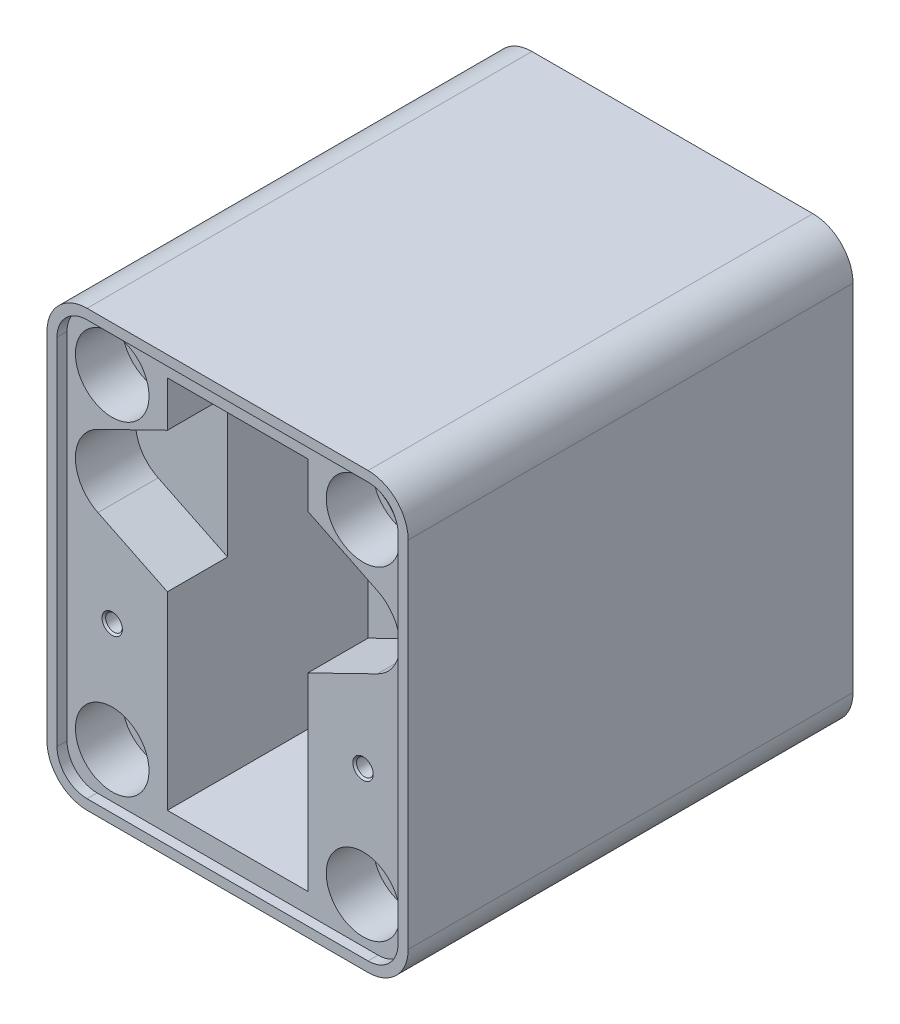
from build123d import *

# Parameters (mm, degrees)
SKETCH1_W                   = 54
SKETCH1_H                   = 65
BOSS_EXTRUDE1_DEPTH         = 65
SKETCH2_W                   = 21
SKETCH2_H                   = 41.5
CUT_EXTRUDE1_DEPTH          = 107.611444039
FILLET1_R                   = 6
SKETCH3_W                   = 21
SKETCH3_H                   = 56
CUT_EXTRUDE2_DEPTH          = 32
CUT_EXTRUDE_THIN3_DEPTH     = 9
CUT_EXTRUDE3_DEPTH          = 9
M3_TAPPED_HOLE1_D           = 2.5
M3_TAPPED_HOLE1_CSINK_D     = 3.05
M3_TAPPED_HOLE1_CSINK_ANGLE = 90
HOLE1_D                     = 6.5
HOLE1_CBORE_D               = 11
HOLE1_CBORE_DEPTH           = 7
EXTRUDE_THIN1_START         = 1.5
EXTRUDE_THIN1_DEPTH         = 1.5
M3_TAPPED_HOLE2_D           = 2.5
M3_TAPPED_HOLE2_CSINK_D     = 3.05
M3_TAPPED_HOLE2_CSINK_ANGLE = 90


with BuildPart() as part:
    # Sketch1 → Boss-Extrude1 (new body)
    with BuildSketch(Plane.XY):
        with Locations((27, 32.5)):
            Rectangle(SKETCH1_W, SKETCH1_H)
    extrude(amount=BOSS_EXTRUDE1_DEPTH)

    # Sketch2 → Cut-Extrude1 (cut, through all)
    with BuildSketch(Plane.XY.offset(65)):
        with Locations((27, 32.5)):
            Rectangle(SKETCH2_W, SKETCH2_H)
    extrude(amount=-CUT_EXTRUDE1_DEPTH, mode=Mode.SUBTRACT)

    # Fillet1
    fillet1_edges = [part.edges().sort_by_distance(p)[0] for p in [
        (0, 65, 32.5),
        (0, 0, 32.5),
        (54, 65, 32.5),
        (54, 0, 32.5),
    ]]
    fillet(fillet1_edges, radius=FILLET1_R)

    # Sketch3 → Cut-Extrude2 (cut)
    with BuildSketch(Plane.XY.offset(65)):
        with Locations((27, 32.5)):
            Rectangle(SKETCH3_W, SKETCH3_H)
    extrude(amount=-CUT_EXTRUDE2_DEPTH, mode=Mode.SUBTRACT)

    # Sketch4 → Cut-Extrude-Thin3 (cut)
    with BuildSketch(Plane.XY.offset(65)):
        with BuildLine():
            Line((6.119863014, 48.642808121), (20.863013699, 55.83321895))
            ThreePointArc((20.863013699, 55.83321895), (27, 57.25), (33.136986301, 55.83321895))
            Line((33.136986301, 55.83321895), (47.880136986, 48.642808121))
            ThreePointArc((47.880136986, 48.642808121), (51.25, 43.25), (47.880136986, 37.857191879))
            Line((47.880136986, 37.857191879), (33.136986301, 30.66678105))
            ThreePointArc((33.136986301, 30.66678105), (27, 29.25), (20.863013699, 30.66678105))
            Line((20.863013699, 30.66678105), (6.119863014, 37.857191879))
            ThreePointArc((6.119863014, 37.857191879), (2.75, 43.25), (6.119863014, 48.642808121))
        make_face()
        with BuildLine():
            Line((6.339041096, 48.193407445), (21.082191781, 55.383818273))
            ThreePointArc((21.082191781, 55.383818273), (27, 56.75), (32.917808219, 55.383818273))
            Line((32.917808219, 55.383818273), (47.660958904, 48.193407445))
            ThreePointArc((47.660958904, 48.193407445), (50.75, 43.25), (47.660958904, 38.306592555))
            Line((47.660958904, 38.306592555), (32.917808219, 31.116181727))
            ThreePointArc((32.917808219, 31.116181727), (27, 29.75), (21.082191781, 31.116181727))
            Line((21.082191781, 31.116181727), (6.339041096, 38.306592555))
            ThreePointArc((6.339041096, 38.306592555), (3.25, 43.25), (6.339041096, 48.193407445))
        make_face(mode=Mode.SUBTRACT)
    extrude(amount=-CUT_EXTRUDE_THIN3_DEPTH, mode=Mode.SUBTRACT)

    # Sketch4<3> → Cut-Extrude3 (cut)
    with BuildSketch(Plane.XY.offset(65)):
        with BuildLine():
            Line((32.917808219, 55.383818273), (47.660958904, 48.193407445))
            ThreePointArc((47.660958904, 48.193407445), (50.75, 43.25), (47.660958904, 38.306592555))
            Line((47.660958904, 38.306592555), (32.917808219, 31.116181727))
            ThreePointArc((32.917808219, 31.116181727), (27, 29.75), (21.082191781, 31.116181727))
            Line((21.082191781, 31.116181727), (6.339041096, 38.306592555))
            ThreePointArc((6.339041096, 38.306592555), (3.25, 43.25), (6.339041096, 48.193407445))
            Line((6.339041096, 48.193407445), (21.082191781, 55.383818273))
            ThreePointArc((21.082191781, 55.383818273), (27, 56.75), (32.917808219, 55.383818273))
        make_face()
    extrude(amount=-CUT_EXTRUDE3_DEPTH, mode=Mode.SUBTRACT)

    # M3 Tapped Hole1 (through all)
    with Locations(Plane(origin=(22, 56.85, 33), x_dir=(1, 0, 0), z_dir=(0, 0, 1))):
        with Locations((0, 0), (10, 0), (10, -48.7), (0, -48.7)):
            CounterSinkHole(M3_TAPPED_HOLE1_D / 2, M3_TAPPED_HOLE1_CSINK_D / 2, counter_sink_angle=M3_TAPPED_HOLE1_CSINK_ANGLE)

    # Hole1 (through all)
    with Locations(Plane(origin=(8.25, 56.75, 65), x_dir=(1, 0, 0), z_dir=(0, 0, 1))):
        with Locations((0, 0), (37.5, 0), (37.5, -48.5), (0, -48.5)):
            CounterBoreHole(HOLE1_D / 2, HOLE1_CBORE_D / 2, HOLE1_CBORE_DEPTH)

    # Sketch10 → Extrude-Thin1 (add)
    with BuildSketch(Plane.XY.offset(65).offset(EXTRUDE_THIN1_START)):
        with BuildLine():
            Line((48, 65), (6, 65))
            ThreePointArc((6, 65), (1.757359313, 63.242640687), (0, 59))
            Line((0, 59), (0, 6))
            ThreePointArc((0, 6), (1.757359313, 1.757359313), (6, 0))
            Line((6, 0), (48, 0))
            ThreePointArc((48, 0), (52.242640687, 1.757359313), (54, 6))
            Line((54, 6), (54, 59))
            ThreePointArc((54, 59), (52.242640687, 63.242640687), (48, 65))
        make_face()
        with BuildLine():
            Line((48, 63.5), (6, 63.5))
            ThreePointArc((6, 63.5), (2.818019485, 62.181980515), (1.5, 59))
            Line((1.5, 59), (1.5, 6))
            ThreePointArc((1.5, 6), (2.818019485, 2.818019485), (6, 1.5))
            Line((6, 1.5), (48, 1.5))
            ThreePointArc((48, 1.5), (51.181980515, 2.818019485), (52.5, 6))
            Line((52.5, 6), (52.5, 59))
            ThreePointArc((52.5, 59), (51.181980515, 62.181980515), (48, 63.5))
        make_face(mode=Mode.SUBTRACT)
    extrude(amount=-EXTRUDE_THIN1_DEPTH)

    # M3 Tapped Hole2 (through all)
    with Locations(Plane(origin=(8.25, 24.550881691, 65), x_dir=(1, 0, 0), z_dir=(0, 0, 1))):
        with Locations((0, 0), (37.5, 0)):
            CounterSinkHole(M3_TAPPED_HOLE2_D / 2, M3_TAPPED_HOLE2_CSINK_D / 2, counter_sink_angle=M3_TAPPED_HOLE2_CSINK_ANGLE)


solid = part.part
